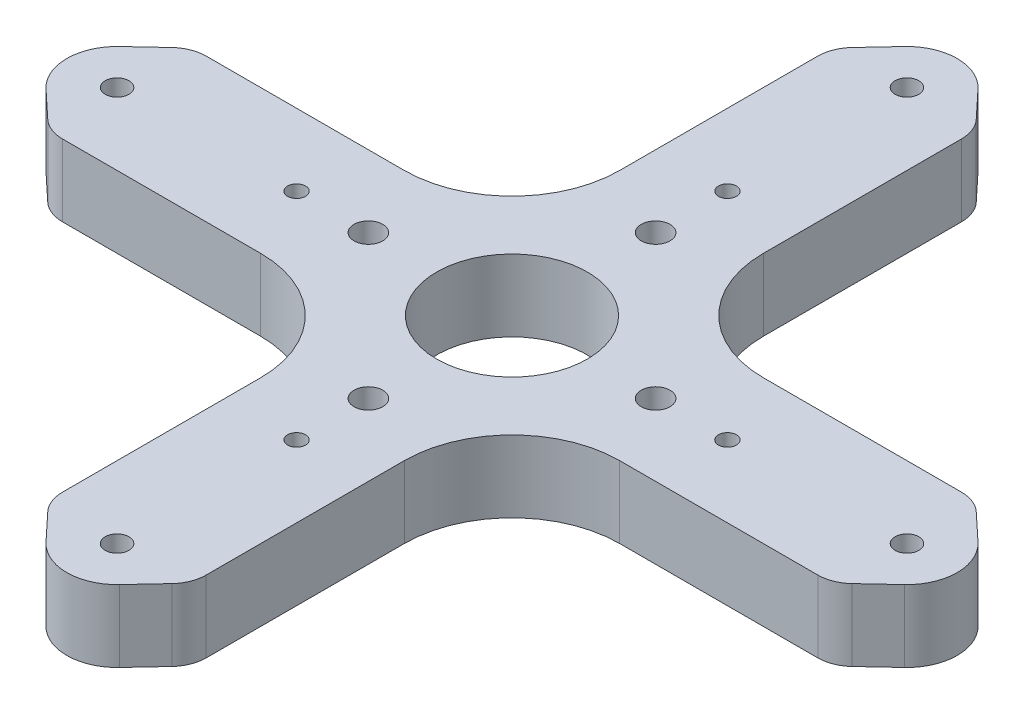
from build123d import *

# Parameters (mm, degrees)
SKETCH1_R             = 2
SKETCH1_R_2           = 10.5
BOSS_EXTRUDE1_DEPTH   = 10
FILLET1_R             = 15
FILLET2_R             = 5
M4X0_7_TAPPED_HOLE1_D = 3.3
M3X0_5_TAPPED_HOLE1_D = 2.5


with BuildPart() as part:
    # Sketch1 → Boss-Extrude1 (new body)
    with BuildSketch(Plane(origin=(0, 0, 0), x_dir=(1, 0, 0), z_dir=(0, 1, 0))):
        with BuildLine():
            Line((10, 10), (54.556312231, 10))
            Line((54.556312231, 10), (59.781818182, 5.112163424))
            ThreePointArc((59.781818182, 5.112163424), (62, 0), (59.781818182, -5.112163424))
            Line((59.781818182, -5.112163424), (54.556312231, -10))
            Line((54.556312231, -10), (10, -10))
            Line((10, -10), (10, -54.556312231))
            Line((10, -54.556312231), (5.112163424, -59.781818182))
            ThreePointArc((5.112163424, -59.781818182), (0, -62), (-5.112163424, -59.781818182))
            Line((-5.112163424, -59.781818182), (-10, -54.556312231))
            Line((-10, -54.556312231), (-10, -10))
            Line((-10, -10), (-54.556312231, -10))
            Line((-54.556312231, -10), (-59.781818182, -5.112163424))
            ThreePointArc((-59.781818182, -5.112163424), (-62, 0), (-59.781818182, 5.112163424))
            Line((-59.781818182, 5.112163424), (-54.556312231, 10))
            Line((-54.556312231, 10), (-10, 10))
            Line((-10, 10), (-10, 54.556312231))
            Line((-10, 54.556312231), (-5.112163424, 59.781818182))
            ThreePointArc((-5.112163424, 59.781818182), (0, 62), (5.112163424, 59.781818182))
            Line((5.112163424, 59.781818182), (10, 54.556312231))
            Line((10, 54.556312231), (10, 10))
        make_face()
        with Locations(Location((-20, 0, 0), (0, 0, 270))):
            Circle(SKETCH1_R, mode=Mode.SUBTRACT)
        with Locations(Location((0, 20, 0), (0, 0, 270))):
            Circle(SKETCH1_R, mode=Mode.SUBTRACT)
        with Locations(Location((20, 0, 0), (0, 0, 270))):
            Circle(SKETCH1_R, mode=Mode.SUBTRACT)
        with Locations(Location((0, -20, 0), (0, 0, 270))):
            Circle(SKETCH1_R, mode=Mode.SUBTRACT)
        with Locations(Location((0, 0, 0), (0, 0, 270))):
            Circle(SKETCH1_R_2, mode=Mode.SUBTRACT)
    extrude(amount=BOSS_EXTRUDE1_DEPTH)

    # Fillet1
    fillet1_edges = [part.edges().sort_by_distance(p)[0] for p in [
        (10, 5, -10),
        (10, 5, 10),
        (-10, 5, 10),
        (-10, 5, -10),
    ]]
    fillet(fillet1_edges, radius=FILLET1_R)

    # Fillet2
    fillet2_edges = [part.edges().sort_by_distance(p)[0] for p in [
        (54.556312231, 5, -10),
        (54.556312231, 5, 10),
        (10, 5, 54.556312231),
        (-10, 5, 54.556312231),
        (-54.556312231, 5, 10),
        (-54.556312231, 5, -10),
        (-10, 5, -54.556312231),
        (10, 5, -54.556312231),
    ]]
    fillet(fillet2_edges, radius=FILLET2_R)

    # M4x0.7 Tapped Hole1 (through all)
    with Locations(Plane(origin=(0, 0, 0), x_dir=(-1, 0, 0), z_dir=(0, -1, 0))):
        with Locations((0, -55), (-55, 0), (0, 55), (55, 0)):
            Hole(M4X0_7_TAPPED_HOLE1_D / 2)

    # M3x0.5 Tapped Hole1 (through all)
    with Locations(Plane(origin=(0, 0, 0), x_dir=(-1, 0, 0), z_dir=(0, -1, 0))):
        with Locations((0, -30), (-30, 0), (0, 30), (30, 0), (0, 0)):
            Hole(M3X0_5_TAPPED_HOLE1_D / 2)


solid = part.part
